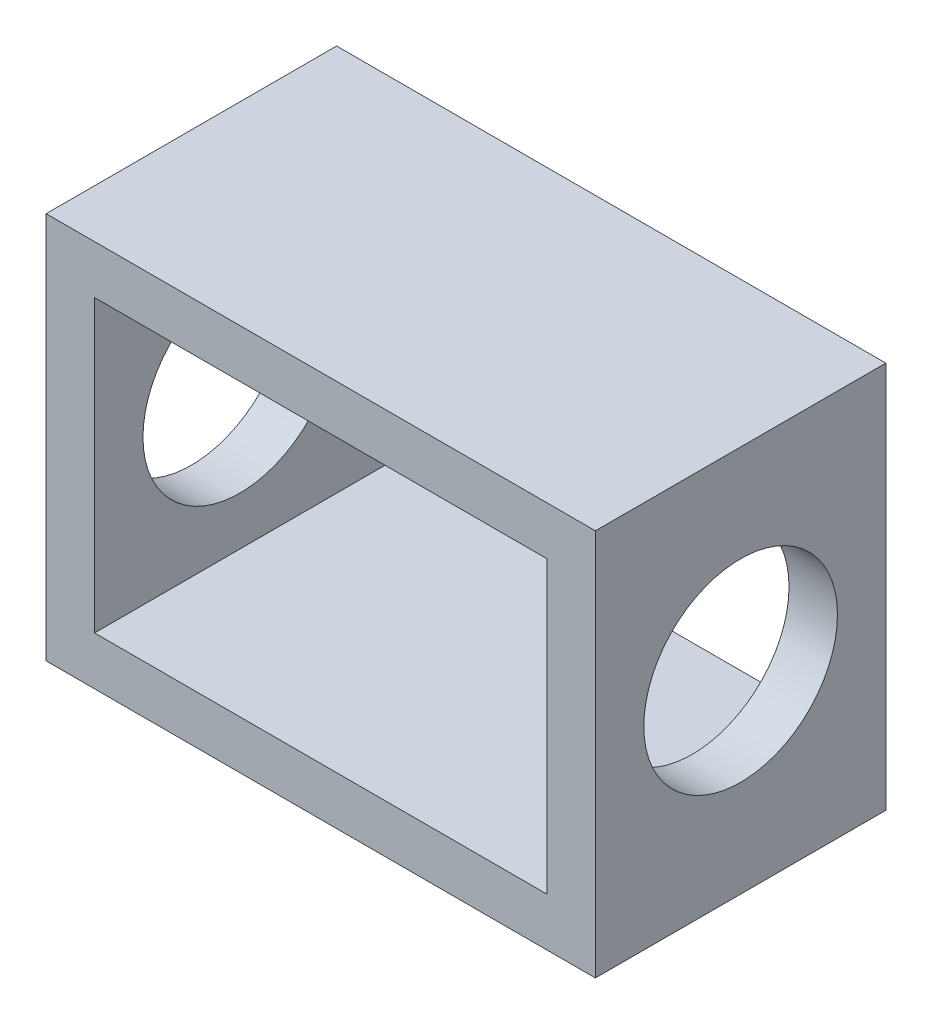
from build123d import *

# Parameters (mm, degrees)
SKETCH1_W           = 56.729559748
SKETCH1_H           = 40
SKETCH1_W_2         = 46.729559748
SKETCH1_H_2         = 30
EXTRUDE_THIN1_DEPTH = 30
SKETCH2_R           = 10
CUT_EXTRUDE1_DEPTH  = 68.217876709


with BuildPart() as part:
    # Sketch1 → Extrude-Thin1 (new body)
    with BuildSketch(Plane.XY):
        Rectangle(SKETCH1_W, SKETCH1_H)
        Rectangle(SKETCH1_W_2, SKETCH1_H_2, mode=Mode.SUBTRACT)
    extrude(amount=EXTRUDE_THIN1_DEPTH)

    # Sketch2 → Cut-Extrude1 (cut, through all)
    with BuildSketch(Plane.ZY.offset(28.364779874)):
        with Locations((15, 0)):
            Circle(SKETCH2_R)
    extrude(amount=-CUT_EXTRUDE1_DEPTH, mode=Mode.SUBTRACT)


solid = part.part
